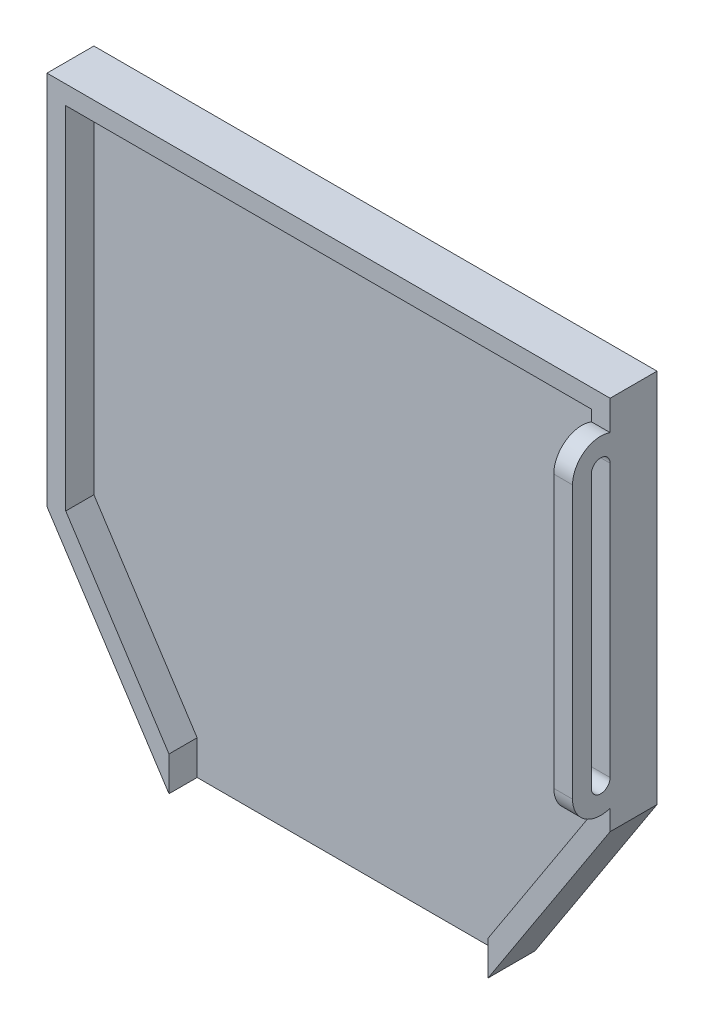
from build123d import *

# Parameters (mm, degrees)
P_IDAT_VYSUNUT_M1_DEPTH = 2
P_IDAT_VYSUNUT_M2_DEPTH = 3
P_IDAT_VYSUNUT_M3_DEPTH = 2


with BuildPart() as part:
    # Skica1 → Přidat vysunutím1 (new body)
    with BuildSketch(Plane.XY):
        Polygon((0, 0), (34, 0), (47, 20), (47, 60), (-13, 60), (-13, 20), align=None)
    extrude(amount=P_IDAT_VYSUNUT_M1_DEPTH)

    # Skica2 → Přidat vysunutím2 (add)
    with BuildSketch(Plane.XY.offset(2)):
        Polygon((-11, 20.592880136), (0, 3.669803213), (0, 0), (-13, 20), (-13, 60), (47, 60), (47, 20), (34, 0), (34, 3.669803213), (45, 20.592880136), (45, 58), (-11, 58), align=None)
    extrude(amount=P_IDAT_VYSUNUT_M2_DEPTH)

    # Skica3 → Přidat vysunutím3 (add)
    with BuildSketch(Plane(origin=(47, 0, 0), x_dir=(0, 0, -1), z_dir=(1, 0, 0))):
        with BuildLine():
            ThreePointArc((-5, 25), (-6, 24), (-7, 25))
            Line((-7, 25), (-7, 54))
            ThreePointArc((-7, 54), (-6, 55), (-5, 54))
            Line((-5, 54), (-5, 56.828427125))
            ThreePointArc((-5, 56.828427125), (-7.732050808, 56.449489743), (-9, 54))
            Line((-9, 54), (-9, 25))
            ThreePointArc((-9, 25), (-7.732050808, 22.550510257), (-5, 22.171572875))
            Line((-5, 22.171572875), (-5, 25))
        make_face()
    extrude(amount=-P_IDAT_VYSUNUT_M3_DEPTH)


solid = part.part
